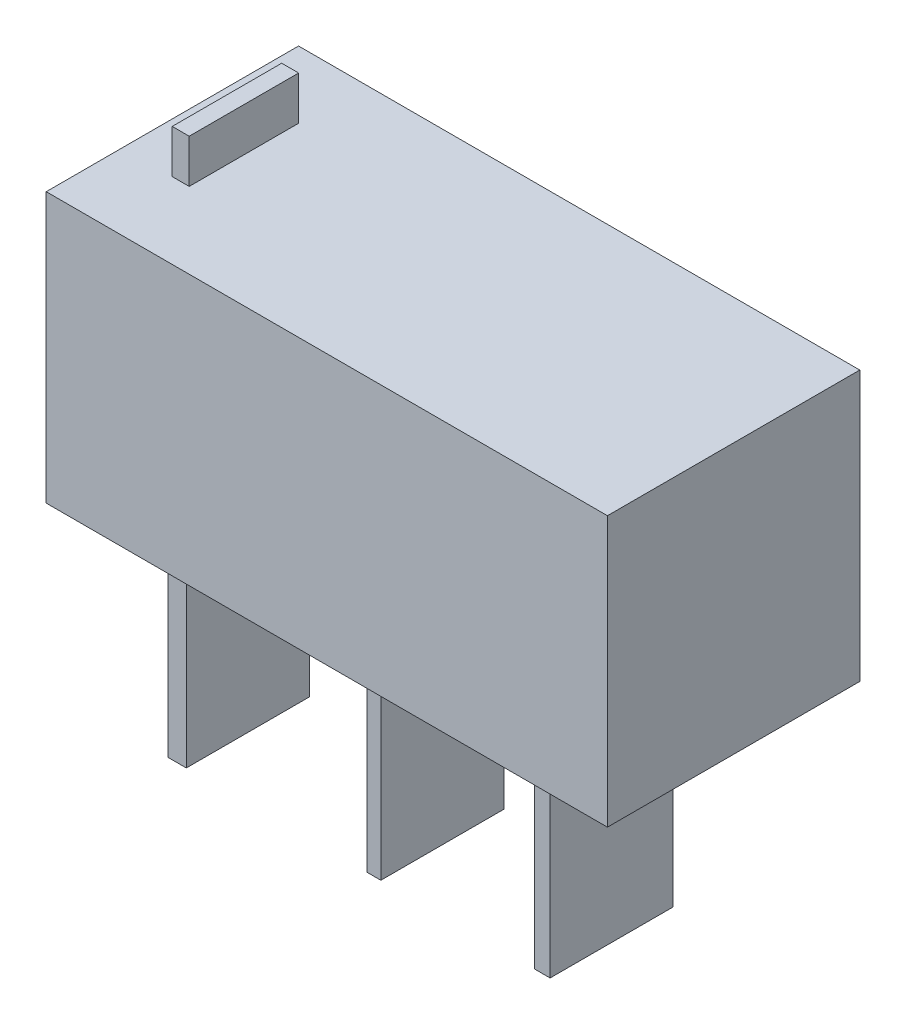
from build123d import *

# Parameters (mm, degrees)
SKETCH1_W           = 12.9
SKETCH1_H           = 5.8
BOSS_EXTRUDE1_DEPTH = 6.2
SKETCH2_W           = 0.389977013
SKETCH2_H           = 2.515896803
BOSS_EXTRUDE2_DEPTH = 1
SKETCH3_W           = 0.417854015
SKETCH3_H           = 2.825804308
SKETCH3_W_2         = 0.316823763
SKETCH3_W_3         = 0.356926389
BOSS_EXTRUDE3_DEPTH = 5


with BuildPart() as part:
    # Sketch1 → Boss-Extrude1 (new body)
    with BuildSketch(Plane(origin=(0, 0, 0), x_dir=(1, 0, 0), z_dir=(0, 1, 0))):
        with Locations((6.45, -2.9)):
            Rectangle(SKETCH1_W, SKETCH1_H)
    extrude(amount=BOSS_EXTRUDE1_DEPTH)

    # Sketch2 → Boss-Extrude2 (add)
    with BuildSketch(Plane(origin=(0, 6.2, 0), x_dir=(1, 0, 0), z_dir=(0, 1, 0))):
        with Locations((1.343594609, -2.794175743)):
            Rectangle(SKETCH2_W, SKETCH2_H)
    extrude(amount=BOSS_EXTRUDE2_DEPTH)

    # Sketch3 → Boss-Extrude3 (add)
    with BuildSketch(Plane(origin=(0, 0, 0), x_dir=(-1, 0, 0), z_dir=(0, -1, 0))):
        with Locations((-1.673057287, -3.048690626)):
            Rectangle(SKETCH3_W, SKETCH3_H)
        with Locations((-6.194757306, -3.048690626)):
            Rectangle(SKETCH3_W_2, SKETCH3_H)
        with Locations((-10.065176498, -3.048690626)):
            Rectangle(SKETCH3_W_3, SKETCH3_H)
    extrude(amount=BOSS_EXTRUDE3_DEPTH)


solid = part.part
